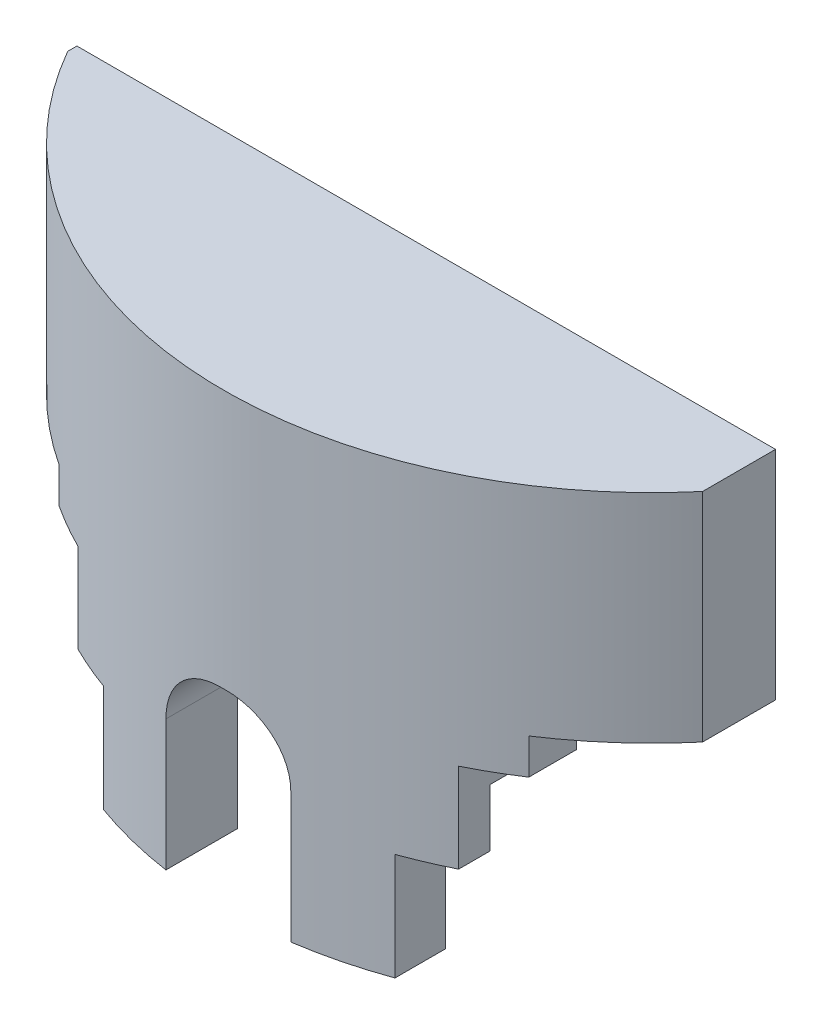
from build123d import *

# Parameters (mm, degrees)
BOSS_EXTRUDE1_DEPTH = 36.5
BOSS_EXTRUDE2_DEPTH = 6
BOSS_EXTRUDE3_DEPTH = 15
BOSS_EXTRUDE4_DEPTH = 18
CUT_EXTRUDE2_DEPTH  = 25
SKETCH5_W           = 21
SKETCH5_H           = 37.8
CUT_EXTRUDE1_DEPTH  = 32
FILLET1_R           = 10
CUT_EXTRUDE3_DEPTH  = 18
SKETCH9_W           = 81.549954628
SKETCH9_H           = 20
CUT_EXTRUDE4_DEPTH  = 18
SKETCH10_W          = 7.5
SKETCH10_H          = 36.5
CUT_EXTRUDE6_DEPTH  = 106.049226723


with BuildPart() as part:
    # Sketch1 → Boss-Extrude1 (new body)
    with BuildSketch(Plane(origin=(0, 0, 0), x_dir=(1, 0, 0), z_dir=(0, 1, 0))):
        with BuildLine():
            Line((-62.5, -34.2), (-62.5, -35.745629103))
            ThreePointArc((-62.5, -35.745629103), (0, -72), (62.5, -35.745629103))
            Line((62.5, -35.745629103), (62.5, -34.2))
            Line((62.5, -34.2), (-62.5, -34.2))
        make_face()
    extrude(amount=-BOSS_EXTRUDE1_DEPTH)

    # Sketch2 → Boss-Extrude2 (add)
    with BuildSketch(Plane.XZ.offset(36.5)):
        with BuildLine():
            ThreePointArc((39.5, 60.197591314), (0, 72), (-39.5, 60.197591314))
            Line((-39.5, 60.197591314), (-39.5, 34.2))
            Line((-39.5, 34.2), (39.5, 34.2))
            Line((39.5, 34.2), (39.5, 60.197591314))
        make_face()
    extrude(amount=BOSS_EXTRUDE2_DEPTH)

    # Sketch3 → Boss-Extrude3 (add)
    with BuildSketch(Plane.XZ.offset(42.5)):
        with BuildLine():
            Line((-32, 64.498061986), (-32, 34.2))
            Line((-32, 34.2), (32, 34.2))
            Line((32, 34.2), (32, 64.498061986))
            ThreePointArc((32, 64.498061986), (0, 72), (-32, 64.498061986))
        make_face()
    extrude(amount=BOSS_EXTRUDE3_DEPTH)

    # Sketch4 → Boss-Extrude4 (add)
    with BuildSketch(Plane.XZ.offset(57.5)):
        with BuildLine():
            Line((-24.5, 34.2), (-24.5, 67.703397256))
            ThreePointArc((-24.5, 67.703397256), (0, 72), (24.5, 67.703397256))
            Line((24.5, 67.703397256), (24.5, 34.2))
            Line((24.5, 34.2), (-24.5, 34.2))
        make_face()
    extrude(amount=BOSS_EXTRUDE4_DEPTH)

    # Sketch7 → Cut-Extrude2 (cut)
    with BuildSketch(Plane(origin=(0, 0, 34.2), x_dir=(-1, 0, 0), z_dir=(0, 0, -1))):
        with BuildLine():
            Line((-32.5, -53.5), (-32.5, -86))
            Line((-32.5, -86), (32.5, -86))
            Line((32.5, -86), (32.5, -53.5))
            ThreePointArc((32.5, -53.5), (0, -21), (-32.5, -53.5))
        make_face()
    extrude(amount=-CUT_EXTRUDE2_DEPTH, mode=Mode.SUBTRACT)

    # Sketch5 → Cut-Extrude1 (cut)
    with BuildSketch(Plane.XZ.offset(75.5)):
        with Locations((0, 53.1)):
            Rectangle(SKETCH5_W, SKETCH5_H)
    extrude(amount=-CUT_EXTRUDE1_DEPTH, mode=Mode.SUBTRACT)

    # Fillet1
    fillet1_edges = [part.edges().sort_by_distance(p)[0] for p in [
        (-10.5, -43.5, 65.215130212),
        (10.5, -43.5, 65.215130212),
    ]]
    fillet(fillet1_edges, radius=FILLET1_R)

    # Sketch8 → Cut-Extrude3 (cut)
    with BuildSketch(Plane(origin=(0, 0, 34.2), x_dir=(-1, 0, 0), z_dir=(0, 0, -1))):
        with BuildLine():
            Line((-27, -2), (27, -2))
            ThreePointArc((27, -2), (47, -22), (27, -42))
            Line((27, -42), (-27, -42))
            ThreePointArc((-27, -42), (-47, -22), (-27, -2))
        make_face()
    extrude(amount=-CUT_EXTRUDE3_DEPTH, mode=Mode.SUBTRACT)

    # Sketch9 → Cut-Extrude4 (cut)
    with BuildSketch(Plane(origin=(0, 0, 34.2), x_dir=(-1, 0, 0), z_dir=(0, 0, -1))):
        with Locations((0, -46.5)):
            Rectangle(SKETCH9_W, SKETCH9_H)
    extrude(amount=-CUT_EXTRUDE4_DEPTH, mode=Mode.SUBTRACT)

    # Sketch10 → Cut-Extrude6 (cut, through all)
    with BuildSketch(Plane(origin=(0, 0, 34.2), x_dir=(-1, 0, 0), z_dir=(0, 0, -1))):
        with Locations((-58.75, -18.25)):
            Rectangle(SKETCH10_W, SKETCH10_H)
    extrude(amount=-CUT_EXTRUDE6_DEPTH, mode=Mode.SUBTRACT)


solid = part.part
